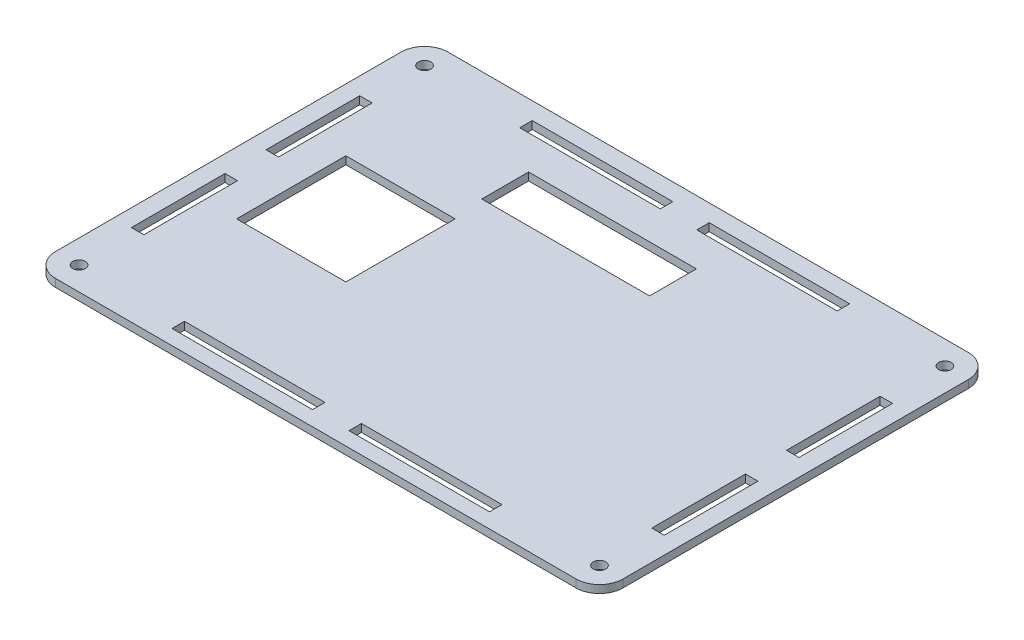
from build123d import *

# Parameters (mm, degrees)
SKETCH1_W           = 145.34
SKETCH1_H           = 100.51
SKETCH1_R           = 1.6
SKETCH1_W_2         = 36
SKETCH1_H_2         = 3.2
SKETCH1_W_3         = 3.2
SKETCH1_H_3         = 24
SKETCH1_W_4         = 28
SKETCH1_H_4         = 28
SKETCH1_W_5         = 43
SKETCH1_H_5         = 12
BOSS_EXTRUDE1_DEPTH = 2
FILLET1_R           = 6
FILLET2_R           = 6
FILLET3_R           = 6


with BuildPart() as part:
    # Sketch1 → Boss-Extrude1 (new body)
    with BuildSketch(Plane(origin=(0, 0, 0), x_dir=(1, 0, 0), z_dir=(0, 1, 0))):
        with Locations((72.67, 50.255)):
            Rectangle(SKETCH1_W, SKETCH1_H)
        with Locations(Location((6, 94.51, 0), (0, 0, 270))):
            Circle(SKETCH1_R, mode=Mode.SUBTRACT)
        with Locations(Location((139.34, 94.51, 0), (0, 0, 270))):
            Circle(SKETCH1_R, mode=Mode.SUBTRACT)
        with Locations(Location((139.34, 6, 0), (0, 0, 270))):
            Circle(SKETCH1_R, mode=Mode.SUBTRACT)
        with Locations(Location((6, 6, 0), (0, 0, 270))):
            Circle(SKETCH1_R, mode=Mode.SUBTRACT)
        with Locations((50, 5.414130674)):
            Rectangle(SKETCH1_W_2, SKETCH1_H_2, mode=Mode.SUBTRACT)
        with Locations((50, 94.51)):
            Rectangle(SKETCH1_W_2, SKETCH1_H_2, mode=Mode.SUBTRACT)
        with Locations((95.34, 94.51)):
            Rectangle(SKETCH1_W_2, SKETCH1_H_2, mode=Mode.SUBTRACT)
        with Locations((95.34, 5.414130674)):
            Rectangle(SKETCH1_W_2, SKETCH1_H_2, mode=Mode.SUBTRACT)
        with Locations((6, 67.51)):
            Rectangle(SKETCH1_W_3, SKETCH1_H_3, mode=Mode.SUBTRACT)
        with Locations((6, 33)):
            Rectangle(SKETCH1_W_3, SKETCH1_H_3, mode=Mode.SUBTRACT)
        with Locations((139.34, 67.51)):
            Rectangle(SKETCH1_W_3, SKETCH1_H_3, mode=Mode.SUBTRACT)
        with Locations((139.34, 33)):
            Rectangle(SKETCH1_W_3, SKETCH1_H_3, mode=Mode.SUBTRACT)
        with Locations((29.946, 50.413)):
            Rectangle(SKETCH1_W_4, SKETCH1_H_4, mode=Mode.SUBTRACT)
        with Locations((64.452, 78.224)):
            Rectangle(SKETCH1_W_5, SKETCH1_H_5, mode=Mode.SUBTRACT)
    extrude(amount=BOSS_EXTRUDE1_DEPTH)

    # Fillet1
    fillet1_edges = [part.edges().sort_by_distance(p)[0] for p in [
        (0, 1, -100.51),
    ]]
    fillet(fillet1_edges, radius=FILLET1_R)

    # Fillet2
    fillet2_edges = [part.edges().sort_by_distance(p)[0] for p in [
        (0, 1, 0),
    ]]
    fillet(fillet2_edges, radius=FILLET2_R)

    # Fillet3
    fillet3_edges = [part.edges().sort_by_distance(p)[0] for p in [
        (145.34, 1, -100.51),
        (145.34, 1, 0),
    ]]
    fillet(fillet3_edges, radius=FILLET3_R)


solid = part.part
